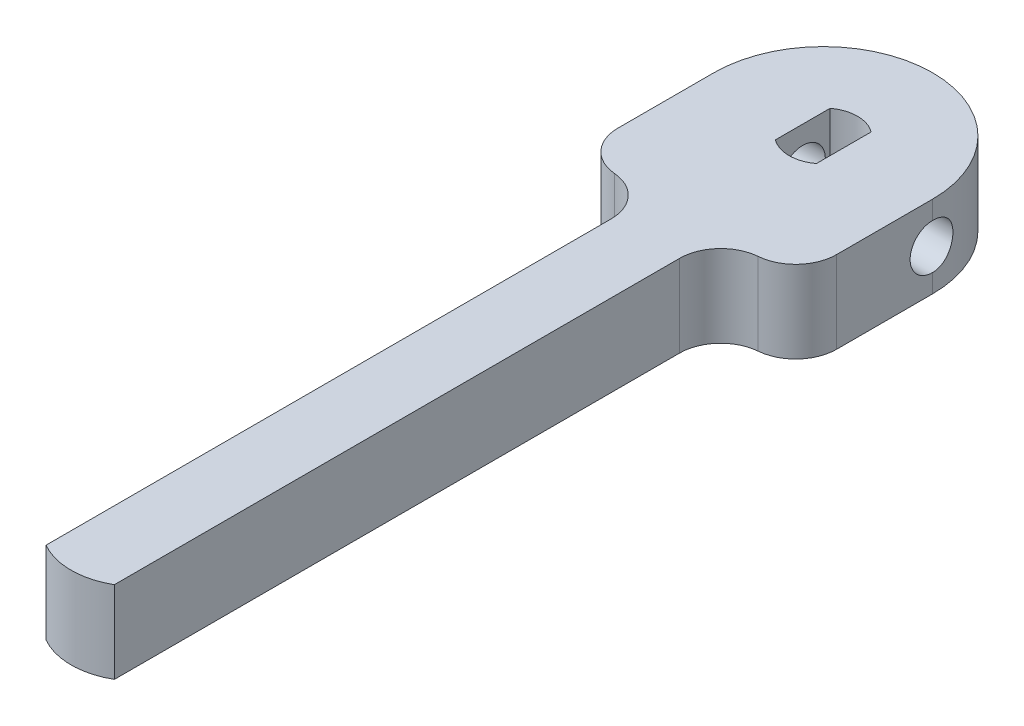
from build123d import *

# Parameters (mm, degrees)
BOSS_EXTRU_1_DEPTH                        = 6
TROU_POUR_TARAUDAGE_POUR_TROU_TARAUD_M4_D = 3.3
CONG_1_R                                  = 3
CONG_2_R                                  = 3
CONG_3_R                                  = 3


with BuildPart() as part:
    # Esquisse1 → Boss.-Extru.1 (new body)
    with BuildSketch(Plane(origin=(0, 0, 0), x_dir=(1, 0, 0), z_dir=(0, 1, 0))):
        with BuildLine():
            Line((8, 0), (8, -10))
            Line((8, -10), (2.5, -10))
            Line((2.5, -10), (2.5, -54.330127019))
            ThreePointArc((2.5, -54.330127019), (0, -55), (-2.5, -54.330127019))
            Line((-2.5, -54.330127019), (-2.5, -10))
            Line((-2.5, -10), (-8, -10))
            Line((-8, -10), (-8, 0))
            ThreePointArc((-8, 0), (0, 8), (8, 0))
        make_face()
        with BuildLine():
            Line((1.5, 2), (1.5, -2))
            ThreePointArc((1.5, -2), (0, -2.5), (-1.5, -2))
            Line((-1.5, -2), (-1.5, 2))
            ThreePointArc((-1.5, 2), (0, 2.5), (1.5, 2))
        make_face(mode=Mode.SUBTRACT)
    extrude(amount=BOSS_EXTRU_1_DEPTH)

    # Trou pour taraudage pour trou taraudé M41 (through all)
    with Locations(Plane(origin=(8, 0, 0), x_dir=(0, 0, -1), z_dir=(1, 0, 0))):
        with Locations((0, 3)):
            Hole(TROU_POUR_TARAUDAGE_POUR_TROU_TARAUD_M4_D / 2)

    # Congé1
    cong_1_edges = [part.edges().sort_by_distance(p)[0] for p in [
        (-2.5, 3, 10),
    ]]
    fillet(cong_1_edges, radius=CONG_1_R)

    # Congé2
    cong_2_edges = [part.edges().sort_by_distance(p)[0] for p in [
        (-8, 3, 10),
        (2.5, 3, 10),
    ]]
    fillet(cong_2_edges, radius=CONG_2_R)

    # Congé3
    cong_3_edges = [part.edges().sort_by_distance(p)[0] for p in [
        (8, 3, 10),
    ]]
    fillet(cong_3_edges, radius=CONG_3_R)


solid = part.part
